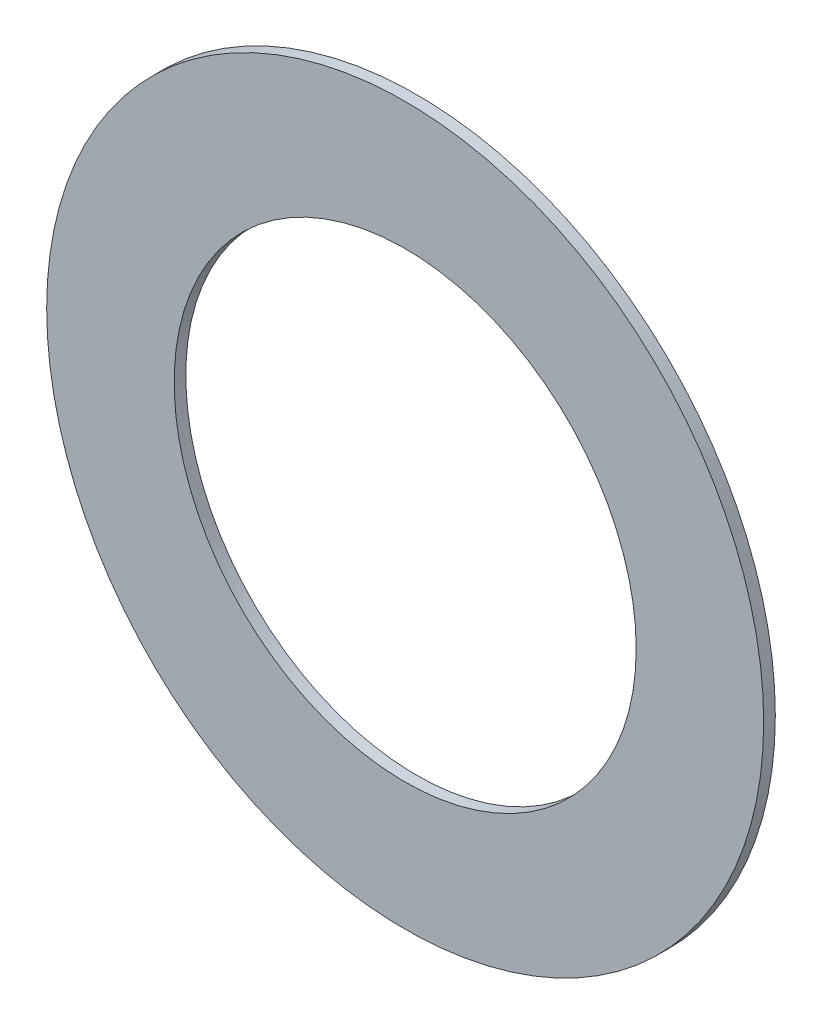
from build123d import *

# Parameters (mm, degrees)
SKETCH1_R      = 7.0358
SKETCH1_R_2    = 4.5339
EXTRUDE1_DEPTH = 0.2286


with BuildPart() as part:
    # Sketch1 → Extrude1 (new body)
    with BuildSketch(Plane.XY):
        Circle(SKETCH1_R)
        Circle(SKETCH1_R_2, mode=Mode.SUBTRACT)
    extrude(amount=EXTRUDE1_DEPTH)


solid = part.part
